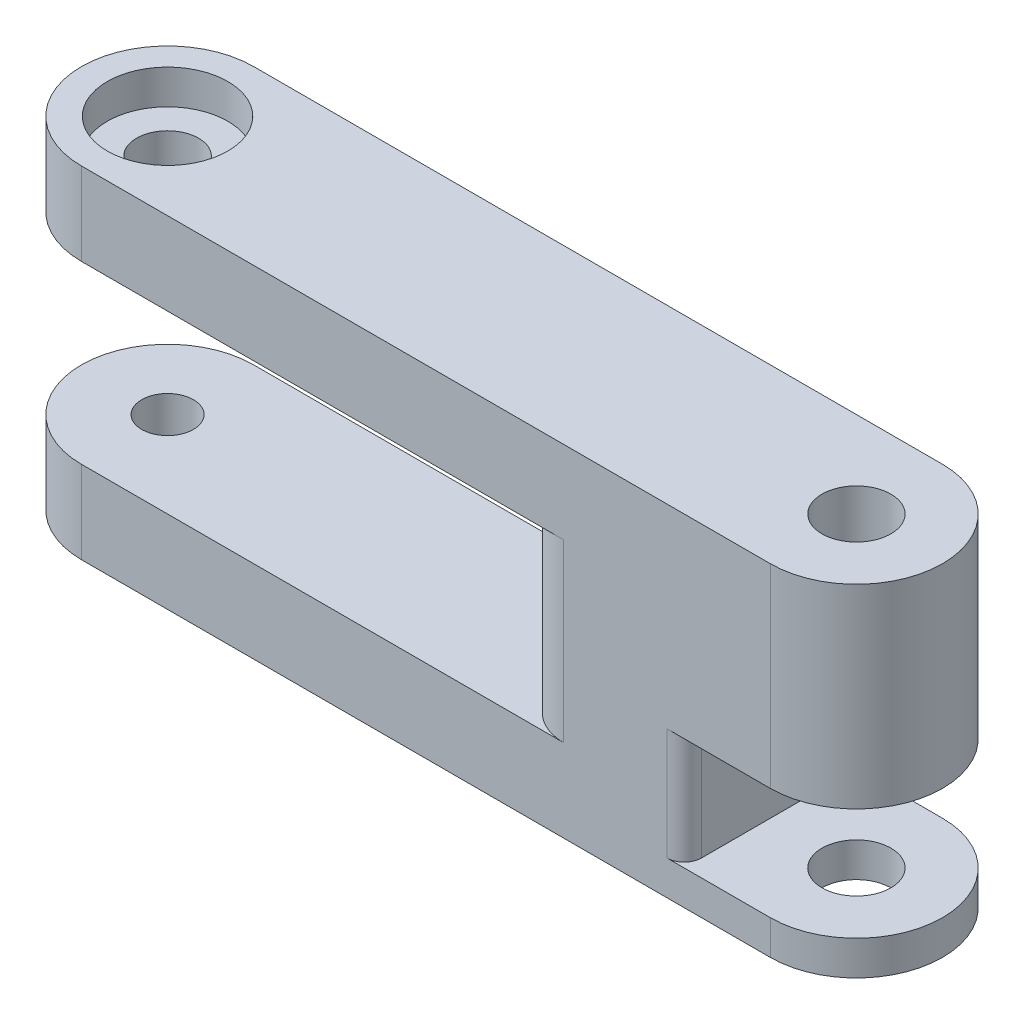
from build123d import *

# Parameters (mm, degrees)
SKETCH1_R           = 2.286
SKETCH1_R_2         = 2.54
BOSS_EXTRUDE1_DEPTH = 12.573
SKETCH2_W           = 38.1
SKETCH2_H           = 12.954
CUT_EXTRUDE1_DEPTH  = 37.433951597
SKETCH3_R           = 4.445
CUT_EXTRUDE2_DEPTH  = 2.54
BOSS_EXTRUDE2_START = -6.096
SKETCH4_R           = 2.286
SKETCH4_R_2         = 1.905
BOSS_EXTRUDE2_DEPTH = 6.096
FILLET1_R           = 3.81
SKETCH6_W           = 12.7
SKETCH6_H           = 8.255
CUT_EXTRUDE4_DEPTH  = 37.433951597
FILLET2_R           = 1.27


with BuildPart() as part:
    # Sketch1 → Boss-Extrude1 (new, symmetric)
    with BuildSketch(Plane(origin=(0, 0, 0), x_dir=(1, 0, 0), z_dir=(0, 1, 0))):
        with BuildLine():
            Line((-25.4, 6.35), (25.4, 6.35))
            ThreePointArc((25.4, 6.35), (31.75, 0), (25.4, -6.35))
            Line((25.4, -6.35), (-25.4, -6.35))
            ThreePointArc((-25.4, -6.35), (-31.75, 0), (-25.4, 6.35))
        make_face()
        with Locations(Location((-25.4, 0, 0), (0, 0, 270))):
            Circle(SKETCH1_R, mode=Mode.SUBTRACT)
        with Locations(Location((25.4, 0, 0), (0, 0, 270))):
            Circle(SKETCH1_R_2, mode=Mode.SUBTRACT)
    extrude(amount=BOSS_EXTRUDE1_DEPTH, both=True)

    # Sketch2 → Cut-Extrude1 (cut, through all)
    with BuildSketch(Plane.XY.offset(6.35)):
        with Locations((-12.7, 0)):
            Rectangle(SKETCH2_W, SKETCH2_H)
    extrude(amount=-CUT_EXTRUDE1_DEPTH, mode=Mode.SUBTRACT)

    # Sketch3 → Cut-Extrude2 (cut)
    with BuildSketch(Plane(origin=(0, 12.573, 0), x_dir=(1, 0, 0), z_dir=(0, 1, 0))):
        with Locations(Location((-25.4, 0, 0), (0, 0, 270))):
            Circle(SKETCH3_R)
    extrude(amount=-CUT_EXTRUDE2_DEPTH, mode=Mode.SUBTRACT)

    # Sketch4 → Boss-Extrude2 (add)
    with BuildSketch(Plane(origin=(0, -6.477, 0), x_dir=(1, 0, 0), z_dir=(0, 1, 0)).offset(BOSS_EXTRUDE2_START)):
        with Locations(Location((-25.4, 0, 0), (0, 0, 270))):
            Circle(SKETCH4_R)
        with Locations(Location((-25.4, 0, 0), (0, 0, 180))):
            Circle(SKETCH4_R_2, mode=Mode.SUBTRACT)
    extrude(amount=BOSS_EXTRUDE2_DEPTH)

    # Fillet1
    fillet1_edges = [part.edges().sort_by_distance(p)[0] for p in [
        (6.35, 0, 6.35),
        (6.35, 0, -6.35),
    ]]
    fillet(fillet1_edges, radius=FILLET1_R)

    # Sketch6 → Cut-Extrude4 (cut, through all)
    with BuildSketch(Plane.XY.offset(6.35)):
        with Locations((25.4, -5.9055)):
            Rectangle(SKETCH6_W, SKETCH6_H)
    extrude(amount=-CUT_EXTRUDE4_DEPTH, mode=Mode.SUBTRACT)

    # Fillet2
    fillet2_edges = [part.edges().sort_by_distance(p)[0] for p in [
        (19.05, -5.9055, 6.35),
        (19.05, -5.9055, -6.35),
    ]]
    fillet(fillet2_edges, radius=FILLET2_R)


solid = part.part
